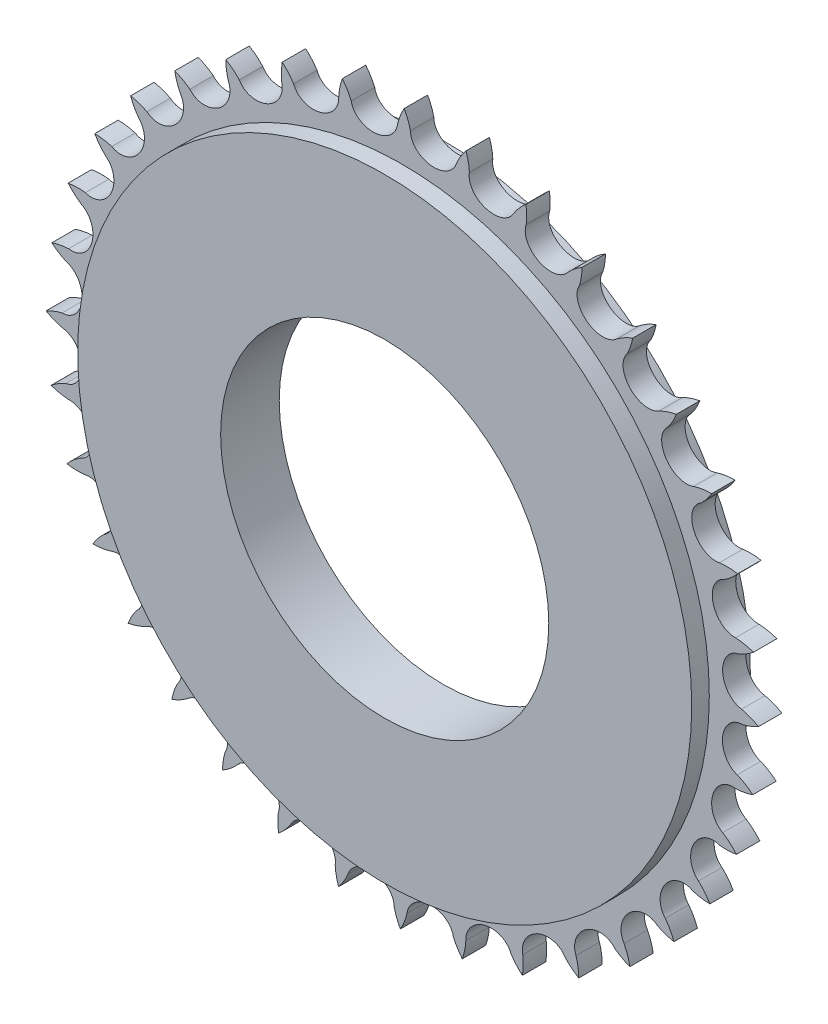
from build123d import *

# Parameters (mm, degrees)
SKETCH1_R           = 35
BOSS_EXTRUDE1_DEPTH = 2.5
SKETCH2_R           = 65.5
SKETCH2_R_2         = 35
BOSS_EXTRUDE2_DEPTH = 6.25


with BuildPart() as part:
    # Sketch1 → Boss-Extrude1 (new, symmetric)
    with BuildSketch(Plane.XY):
        with BuildLine():
            ThreePointArc((14.312905663, 71.168394833), (14.082724944, 72.996610627), (13.596372675, 74.77391691))
            ThreePointArc((13.596372675, 74.77391691), (12.458797356, 73.189476577), (11.571086117, 71.452669872))
            add(Edge.make_bspline(
                [(6.714453556, 68.295982547), (10.582574124, 68.27534589), (11.571086117, 71.452669872)],
                knots=[4.71238898, 4.71238898, 4.71238898, 6.02930256, 6.02930256, 6.02930256], degree=2, weights=[1, 0.790937459, 1]))
            add(Edge.make_bspline(
                [(1.737198395, 72.572596986), (1.714524712, 68.322657469), (6.714453556, 68.295982547)],
                knots=[3.141592654, 3.141592654, 3.141592654, 4.71238898, 4.71238898, 4.71238898], degree=2, weights=[1, 0.707106781, 1]))
            ThreePointArc((1.737198395, 72.572596986), (1.193048297, 74.333067612), (0.405458815, 75.998918434))
            ThreePointArc((0.405458815, 75.998918434), (-0.439699002, 74.241011429), (-1.012330594, 72.376441281))
            add(Edge.make_bspline(
                [(-5.247026992, 68.424365736), (-1.434088349, 69.075734684), (-1.012330594, 72.376441281)],
                knots=[4.71238898, 4.71238898, 4.71238898, 6.02930256, 6.02930256, 6.02930256], degree=2, weights=[1, 0.790937459, 1]))
            add(Edge.make_bspline(
                [(-10.891292767, 71.771717504), (-10.175627734, 67.582406873), (-5.247026992, 68.424365736)],
                knots=[0, 0, 0, 1.570796327, 1.570796327, 1.570796327], degree=2, weights=[1, 0.707106781, 1]))
            ThreePointArc((-10.891292767, 71.771717504), (-11.732878518, 73.410951952), (-12.797774707, 74.914731279))
            ThreePointArc((-12.797774707, 74.914731279), (-13.324835329, 73.036770716), (-13.564988152, 71.101091146))
            add(Edge.make_bspline(
                [(-17.04907928, 66.473709196), (-13.407176773, 67.777292233), (-13.564988152, 71.101091146)],
                knots=[4.71238898, 4.71238898, 4.71238898, 6.02930256, 6.02930256, 6.02930256], degree=2, weights=[1, 0.790937459, 1]))
            add(Edge.make_bspline(
                [(-23.18885751, 68.790090703), (-21.75659888, 64.788699043), (-17.04907928, 66.473709196)],
                knots=[0, 0, 0, 1.570796327, 1.570796327, 1.570796327], degree=2, weights=[1, 0.707106781, 1]))
            ThreePointArc((-23.18885751, 68.790090703), (-24.302307757, 70.258281665), (-25.612154319, 71.554297922))
            ThreePointArc((-25.612154319, 71.554297922), (-25.805103277, 69.613344683), (-25.705480409, 67.665370336))
            add(Edge.make_bspline(
                [(-28.333103921, 62.50328264), (-24.972894916, 64.419471055), (-25.705480409, 67.665370336)],
                knots=[4.71238898, 4.71238898, 4.71238898, 6.02930256, 6.02930256, 6.02930256], degree=2, weights=[1, 0.790937459, 1]))
            add(Edge.make_bspline(
                [(-34.781840551, 63.718311806), (-32.676506779, 60.026419378), (-28.333103921, 62.50328264)],
                knots=[0, 0, 0, 1.570796327, 1.570796327, 1.570796327], degree=2, weights=[1, 0.707106781, 1]))
            ThreePointArc((-34.781840551, 63.718311806), (-36.133323673, 64.970849042), (-37.648321583, 66.019723431))
            ThreePointArc((-37.648321583, 66.019723431), (-37.50129622, 64.074752399), (-37.064924652, 62.173671488))
            add(Edge.make_bspline(
                [(-38.756241537, 56.633725469), (-35.779824283, 59.104296847), (-37.064924652, 62.173671488)],
                knots=[4.71238898, 4.71238898, 4.71238898, 6.02930256, 6.02930256, 6.02930256], degree=2, weights=[1, 0.790937459, 1]))
            add(Edge.make_bspline(
                [(-45.317994968, 56.710484248), (-42.603555554, 53.440267334), (-38.756241537, 56.633725469)],
                knots=[3.141592654, 3.141592654, 3.141592654, 4.71238898, 4.71238898, 4.71238898], degree=2, weights=[1, 0.707106781, 1]))
            ThreePointArc((-45.317994968, 56.710484248), (-46.866446833, 57.709310048), (-48.540563647, 58.479173052))
            ThreePointArc((-48.540563647, 58.479173052), (-48.058031254, 56.589281186), (-47.298169915, 54.792857093))
            add(Edge.make_bspline(
                [(-48.001790366, 49.043381207), (-45.499601795, 51.993268487), (-47.298169915, 54.792857093)],
                knots=[4.71238898, 4.71238898, 4.71238898, 6.02930256, 6.02930256, 6.02930256], degree=2, weights=[1, 0.790937459, 1]))
            add(Edge.make_bspline(
                [(-54.47718504, 47.979537323), (-51.236116852, 45.23035981), (-48.001790366, 49.043381207)],
                knots=[0, 0, 0, 1.570796327, 1.570796327, 1.570796327], degree=2, weights=[1, 0.707106781, 1]))
            ThreePointArc((-54.47718504, 47.979537323), (-56.175556721, 48.69430287), (-57.957925247, 49.161762591))
            ThreePointArc((-57.957925247, 49.161762591), (-57.154547327, 47.3843733), (-56.094284219, 45.747189463))
            add(Edge.make_bspline(
                [(-55.788829084, 39.962878625), (-53.836896931, 43.302450974), (-56.094284219, 45.747189463)],
                knots=[4.71238898, 4.71238898, 4.71238898, 6.02930256, 6.02930256, 6.02930256], degree=2, weights=[1, 0.790937459, 1]))
            add(Edge.make_bspline(
                [(-61.981113411, 37.790756435), (-58.311894666, 35.64615069), (-55.788829084, 39.962878625)],
                knots=[0, 0, 0, 1.570796327, 1.570796327, 1.570796327], degree=2, weights=[1, 0.707106781, 1]))
            ThreePointArc((-61.981113411, 37.790756435), (-63.777800745, 38.19974394), (-65.614264617, 38.350596851))
            ThreePointArc((-65.614264617, 38.350596851), (-64.514451401, 36.739715208), (-63.186002082, 35.311516629))
            add(Edge.make_bspline(
                [(-61.880752461, 29.668124198), (-60.538385196, 33.2959104), (-63.186002082, 35.311516629)],
                knots=[1.570796327, 1.570796327, 1.570796327, 2.887709906, 2.887709906, 2.887709906], degree=2, weights=[1, 0.790937459, 1]))
            add(Edge.make_bspline(
                [(-67.601777015, 26.453722536), (-63.615895068, 24.978851319), (-61.880752461, 29.668124198)],
                knots=[0, 0, 0, 1.570796327, 1.570796327, 1.570796327], degree=2, weights=[1, 0.707106781, 1]))
            ThreePointArc((-67.601777015, 26.453722536), (-69.442188566, 26.54450512), (-71.276947758, 26.374167631))
            ThreePointArc((-71.276947758, 26.374167631), (-69.914116515, 24.978739462), (-68.357845246, 23.802921231))
            add(Edge.make_bspline(
                [(-66.092460487, 18.47191883), (-65.40044526, 22.277690438), (-68.357845246, 23.802921231)],
                knots=[4.71238898, 4.71238898, 4.71238898, 6.02930256, 6.02930256, 6.02930256], degree=2, weights=[1, 0.790937459, 1]))
            add(Edge.make_bspline(
                [(-71.168394833, 14.312905663), (-66.98695869, 13.552582191), (-66.092460487, 18.47191883)],
                knots=[0, 0, 0, 1.570796327, 1.570796327, 1.570796327], degree=2, weights=[1, 0.707106781, 1]))
            ThreePointArc((-71.168394833, 14.312905663), (-72.996610627, 14.082724944), (-74.77391691, 13.596372675))
            ThreePointArc((-74.77391691, 13.596372675), (-73.189476577, 12.458797356), (-71.452669872, 11.571086117))
            add(Edge.make_bspline(
                [(-68.295982547, 6.714453556), (-68.27534589, 10.582574124), (-71.452669872, 11.571086117)],
                knots=[4.71238898, 4.71238898, 4.71238898, 6.02930256, 6.02930256, 6.02930256], degree=2, weights=[1, 0.790937459, 1]))
            add(Edge.make_bspline(
                [(-72.572596986, 1.737198395), (-68.322657469, 1.714524712), (-68.295982547, 6.714453556)],
                knots=[3.141592654, 3.141592654, 3.141592654, 4.71238898, 4.71238898, 4.71238898], degree=2, weights=[1, 0.707106781, 1]))
            ThreePointArc((-72.572596986, 1.737198395), (-74.333067612, 1.193048297), (-75.998918434, 0.405458815))
            ThreePointArc((-75.998918434, 0.405458815), (-74.241011429, -0.439699002), (-72.376441281, -1.012330594))
            add(Edge.make_bspline(
                [(-68.424365735, -5.247026992), (-69.075734684, -1.434088349), (-72.376441281, -1.012330594)],
                knots=[1.570796327, 1.570796327, 1.570796327, 2.887709906, 2.887709906, 2.887709906], degree=2, weights=[1, 0.790937459, 1]))
            add(Edge.make_bspline(
                [(-71.771717504, -10.891292767), (-67.582406873, -10.175627734), (-68.424365735, -5.247026992)],
                knots=[0, 0, 0, 1.570796327, 1.570796327, 1.570796327], degree=2, weights=[1, 0.707106781, 1]))
            ThreePointArc((-71.771717504, -10.891292767), (-73.410951952, -11.732878518), (-74.914731279, -12.797774707))
            ThreePointArc((-74.914731279, -12.797774707), (-73.036770716, -13.324835329), (-71.101091146, -13.564988152))
            add(Edge.make_bspline(
                [(-66.473709196, -17.04907928), (-67.777292233, -13.407176773), (-71.101091146, -13.564988152)],
                knots=[1.570796327, 1.570796327, 1.570796327, 2.887709906, 2.887709906, 2.887709906], degree=2, weights=[1, 0.790937459, 1]))
            add(Edge.make_bspline(
                [(-68.790090703, -23.18885751), (-64.788699043, -21.75659888), (-66.473709196, -17.04907928)],
                knots=[0, 0, 0, 1.570796327, 1.570796327, 1.570796327], degree=2, weights=[1, 0.707106781, 1]))
            ThreePointArc((-68.790090703, -23.18885751), (-70.258281665, -24.302307757), (-71.554297922, -25.612154319))
            ThreePointArc((-71.554297922, -25.612154319), (-69.613344683, -25.805103277), (-67.665370336, -25.705480409))
            add(Edge.make_bspline(
                [(-62.50328264, -28.333103921), (-64.419471055, -24.972894916), (-67.665370336, -25.705480409)],
                knots=[4.71238898, 4.71238898, 4.71238898, 6.02930256, 6.02930256, 6.02930256], degree=2, weights=[1, 0.790937459, 1]))
            add(Edge.make_bspline(
                [(-63.718311806, -34.781840551), (-60.026419378, -32.676506779), (-62.50328264, -28.333103921)],
                knots=[0, 0, 0, 1.570796327, 1.570796327, 1.570796327], degree=2, weights=[1, 0.707106781, 1]))
            ThreePointArc((-63.718311806, -34.781840551), (-64.970849042, -36.133323673), (-66.019723431, -37.648321583))
            ThreePointArc((-66.019723431, -37.648321583), (-64.074752399, -37.50129622), (-62.173671488, -37.064924652))
            add(Edge.make_bspline(
                [(-56.633725469, -38.756241537), (-59.104296847, -35.779824283), (-62.173671488, -37.064924652)],
                knots=[4.71238898, 4.71238898, 4.71238898, 6.02930256, 6.02930256, 6.02930256], degree=2, weights=[1, 0.790937459, 1]))
            add(Edge.make_bspline(
                [(-56.710484248, -45.317994968), (-53.440267334, -42.603555554), (-56.633725469, -38.756241537)],
                knots=[3.141592654, 3.141592654, 3.141592654, 4.71238898, 4.71238898, 4.71238898], degree=2, weights=[1, 0.707106781, 1]))
            ThreePointArc((-56.710484248, -45.317994968), (-57.709310048, -46.866446833), (-58.479173052, -48.540563647))
            ThreePointArc((-58.479173052, -48.540563647), (-56.589281186, -48.058031254), (-54.792857093, -47.298169915))
            add(Edge.make_bspline(
                [(-49.043381207, -48.001790366), (-51.993268487, -45.499601795), (-54.792857093, -47.298169915)],
                knots=[1.570796327, 1.570796327, 1.570796327, 2.887709906, 2.887709906, 2.887709906], degree=2, weights=[1, 0.790937459, 1]))
            add(Edge.make_bspline(
                [(-47.979537323, -54.47718504), (-45.23035981, -51.236116852), (-49.043381207, -48.001790366)],
                knots=[0, 0, 0, 1.570796327, 1.570796327, 1.570796327], degree=2, weights=[1, 0.707106781, 1]))
            ThreePointArc((-47.979537323, -54.47718504), (-48.69430287, -56.175556721), (-49.161762591, -57.957925247))
            ThreePointArc((-49.161762591, -57.957925247), (-47.3843733, -57.154547327), (-45.747189463, -56.094284219))
            add(Edge.make_bspline(
                [(-39.962878625, -55.788829084), (-43.302450974, -53.836896931), (-45.747189463, -56.094284219)],
                knots=[4.71238898, 4.71238898, 4.71238898, 6.02930256, 6.02930256, 6.02930256], degree=2, weights=[1, 0.790937459, 1]))
            add(Edge.make_bspline(
                [(-37.790756435, -61.981113411), (-35.64615069, -58.311894666), (-39.962878625, -55.788829084)],
                knots=[0, 0, 0, 1.570796327, 1.570796327, 1.570796327], degree=2, weights=[1, 0.707106781, 1]))
            ThreePointArc((-37.790756435, -61.981113411), (-38.19974394, -63.777800745), (-38.350596851, -65.614264617))
            ThreePointArc((-38.350596851, -65.614264617), (-36.739715208, -64.514451401), (-35.311516629, -63.186002082))
            add(Edge.make_bspline(
                [(-29.668124198, -61.880752461), (-33.2959104, -60.538385196), (-35.311516629, -63.186002082)],
                knots=[4.71238898, 4.71238898, 4.71238898, 6.02930256, 6.02930256, 6.02930256], degree=2, weights=[1, 0.790937459, 1]))
            add(Edge.make_bspline(
                [(-26.453722536, -67.601777015), (-24.978851319, -63.615895068), (-29.668124198, -61.880752461)],
                knots=[0, 0, 0, 1.570796327, 1.570796327, 1.570796327], degree=2, weights=[1, 0.707106781, 1]))
            ThreePointArc((-26.453722536, -67.601777015), (-26.54450512, -69.442188566), (-26.374167631, -71.276947758))
            ThreePointArc((-26.374167631, -71.276947758), (-24.978739462, -69.914116515), (-23.802921231, -68.357845246))
            add(Edge.make_bspline(
                [(-18.47191883, -66.092460487), (-22.277690438, -65.40044526), (-23.802921231, -68.357845246)],
                knots=[4.71238898, 4.71238898, 4.71238898, 6.02930256, 6.02930256, 6.02930256], degree=2, weights=[1, 0.790937459, 1]))
            add(Edge.make_bspline(
                [(-14.312905663, -71.168394833), (-13.552582191, -66.98695869), (-18.47191883, -66.092460487)],
                knots=[0, 0, 0, 1.570796327, 1.570796327, 1.570796327], degree=2, weights=[1, 0.707106781, 1]))
            ThreePointArc((-14.312905663, -71.168394833), (-14.082724944, -72.996610627), (-13.596372675, -74.77391691))
            ThreePointArc((-13.596372675, -74.77391691), (-12.458797356, -73.189476577), (-11.571086117, -71.452669872))
            add(Edge.make_bspline(
                [(-6.714453556, -68.295982547), (-10.582574124, -68.27534589), (-11.571086117, -71.452669872)],
                knots=[4.71238898, 4.71238898, 4.71238898, 6.02930256, 6.02930256, 6.02930256], degree=2, weights=[1, 0.790937459, 1]))
            add(Edge.make_bspline(
                [(-1.737198395, -72.572596986), (-1.714524712, -68.322657469), (-6.714453556, -68.295982547)],
                knots=[0, 0, 0, 1.570796327, 1.570796327, 1.570796327], degree=2, weights=[1, 0.707106781, 1]))
            ThreePointArc((-1.737198395, -72.572596986), (-1.193048297, -74.333067612), (-0.405458815, -75.998918434))
            ThreePointArc((-0.405458815, -75.998918434), (0.439699002, -74.241011429), (1.012330594, -72.376441281))
            add(Edge.make_bspline(
                [(5.247026992, -68.424365736), (1.434088349, -69.075734684), (1.012330594, -72.376441281)],
                knots=[4.71238898, 4.71238898, 4.71238898, 6.02930256, 6.02930256, 6.02930256], degree=2, weights=[1, 0.790937459, 1]))
            add(Edge.make_bspline(
                [(10.891292767, -71.771717504), (10.175627734, -67.582406873), (5.247026992, -68.424365736)],
                knots=[3.141592654, 3.141592654, 3.141592654, 4.71238898, 4.71238898, 4.71238898], degree=2, weights=[1, 0.707106781, 1]))
            ThreePointArc((10.891292767, -71.771717504), (11.732878518, -73.410951952), (12.797774707, -74.914731279))
            ThreePointArc((12.797774707, -74.914731279), (13.324835329, -73.036770716), (13.564988152, -71.101091146))
            add(Edge.make_bspline(
                [(17.04907928, -66.473709196), (13.407176773, -67.777292233), (13.564988152, -71.101091146)],
                knots=[4.71238898, 4.71238898, 4.71238898, 6.02930256, 6.02930256, 6.02930256], degree=2, weights=[1, 0.790937459, 1]))
            add(Edge.make_bspline(
                [(23.18885751, -68.790090703), (21.75659888, -64.788699043), (17.04907928, -66.473709196)],
                knots=[0, 0, 0, 1.570796327, 1.570796327, 1.570796327], degree=2, weights=[1, 0.707106781, 1]))
            ThreePointArc((23.18885751, -68.790090703), (24.302307757, -70.258281665), (25.612154319, -71.554297922))
            ThreePointArc((25.612154319, -71.554297922), (25.805103277, -69.613344683), (25.705480409, -67.665370336))
            add(Edge.make_bspline(
                [(28.333103921, -62.50328264), (24.972894916, -64.419471055), (25.705480409, -67.665370336)],
                knots=[1.570796327, 1.570796327, 1.570796327, 2.887709906, 2.887709906, 2.887709906], degree=2, weights=[1, 0.790937459, 1]))
            add(Edge.make_bspline(
                [(34.781840551, -63.718311806), (32.676506779, -60.026419378), (28.333103921, -62.50328264)],
                knots=[3.141592654, 3.141592654, 3.141592654, 4.71238898, 4.71238898, 4.71238898], degree=2, weights=[1, 0.707106781, 1]))
            ThreePointArc((34.781840551, -63.718311806), (36.133323673, -64.970849042), (37.648321583, -66.019723431))
            ThreePointArc((37.648321583, -66.019723431), (37.50129622, -64.074752399), (37.064924652, -62.173671488))
            add(Edge.make_bspline(
                [(38.756241537, -56.633725469), (35.779824283, -59.104296847), (37.064924652, -62.173671488)],
                knots=[4.71238898, 4.71238898, 4.71238898, 6.02930256, 6.02930256, 6.02930256], degree=2, weights=[1, 0.790937459, 1]))
            add(Edge.make_bspline(
                [(45.317994968, -56.710484248), (42.603555554, -53.440267334), (38.756241537, -56.633725469)],
                knots=[3.141592654, 3.141592654, 3.141592654, 4.71238898, 4.71238898, 4.71238898], degree=2, weights=[1, 0.707106781, 1]))
            ThreePointArc((45.317994968, -56.710484248), (46.866446833, -57.709310048), (48.540563647, -58.479173052))
            ThreePointArc((48.540563647, -58.479173052), (48.058031254, -56.589281186), (47.298169915, -54.792857093))
            add(Edge.make_bspline(
                [(48.001790366, -49.043381207), (45.499601795, -51.993268487), (47.298169915, -54.792857093)],
                knots=[4.71238898, 4.71238898, 4.71238898, 6.02930256, 6.02930256, 6.02930256], degree=2, weights=[1, 0.790937459, 1]))
            add(Edge.make_bspline(
                [(54.47718504, -47.979537323), (51.236116852, -45.23035981), (48.001790366, -49.043381207)],
                knots=[0, 0, 0, 1.570796327, 1.570796327, 1.570796327], degree=2, weights=[1, 0.707106781, 1]))
            ThreePointArc((54.47718504, -47.979537323), (56.175556721, -48.69430287), (57.957925247, -49.161762591))
            ThreePointArc((57.957925247, -49.161762591), (57.154547327, -47.3843733), (56.094284219, -45.747189463))
            add(Edge.make_bspline(
                [(55.788829084, -39.962878625), (53.836896931, -43.302450974), (56.094284219, -45.747189463)],
                knots=[4.71238898, 4.71238898, 4.71238898, 6.02930256, 6.02930256, 6.02930256], degree=2, weights=[1, 0.790937459, 1]))
            add(Edge.make_bspline(
                [(61.981113411, -37.790756435), (58.311894666, -35.64615069), (55.788829084, -39.962878625)],
                knots=[0, 0, 0, 1.570796327, 1.570796327, 1.570796327], degree=2, weights=[1, 0.707106781, 1]))
            ThreePointArc((61.981113411, -37.790756435), (63.777800745, -38.19974394), (65.614264617, -38.350596851))
            ThreePointArc((65.614264617, -38.350596851), (64.514451401, -36.739715208), (63.186002082, -35.311516629))
            add(Edge.make_bspline(
                [(61.880752461, -29.668124198), (60.538385196, -33.2959104), (63.186002082, -35.311516629)],
                knots=[4.71238898, 4.71238898, 4.71238898, 6.02930256, 6.02930256, 6.02930256], degree=2, weights=[1, 0.790937459, 1]))
            add(Edge.make_bspline(
                [(67.601777015, -26.453722536), (63.615895068, -24.978851319), (61.880752461, -29.668124198)],
                knots=[0, 0, 0, 1.570796327, 1.570796327, 1.570796327], degree=2, weights=[1, 0.707106781, 1]))
            ThreePointArc((67.601777015, -26.453722536), (69.442188566, -26.54450512), (71.276947758, -26.374167631))
            ThreePointArc((71.276947758, -26.374167631), (69.914116515, -24.978739462), (68.357845246, -23.802921231))
            add(Edge.make_bspline(
                [(66.092460487, -18.47191883), (65.40044526, -22.277690438), (68.357845246, -23.802921231)],
                knots=[4.71238898, 4.71238898, 4.71238898, 6.02930256, 6.02930256, 6.02930256], degree=2, weights=[1, 0.790937459, 1]))
            add(Edge.make_bspline(
                [(71.168394833, -14.312905663), (66.98695869, -13.552582191), (66.092460487, -18.47191883)],
                knots=[0, 0, 0, 1.570796327, 1.570796327, 1.570796327], degree=2, weights=[1, 0.707106781, 1]))
            ThreePointArc((71.168394833, -14.312905663), (72.996610627, -14.082724944), (74.77391691, -13.596372675))
            ThreePointArc((74.77391691, -13.596372675), (73.189476577, -12.458797356), (71.452669872, -11.571086117))
            add(Edge.make_bspline(
                [(68.295982547, -6.714453556), (68.27534589, -10.582574124), (71.452669872, -11.571086117)],
                knots=[4.71238898, 4.71238898, 4.71238898, 6.02930256, 6.02930256, 6.02930256], degree=2, weights=[1, 0.790937459, 1]))
            add(Edge.make_bspline(
                [(72.572596986, -1.737198395), (68.322657469, -1.714524712), (68.295982547, -6.714453556)],
                knots=[0, 0, 0, 1.570796327, 1.570796327, 1.570796327], degree=2, weights=[1, 0.707106781, 1]))
            ThreePointArc((72.572596986, -1.737198395), (74.333067612, -1.193048297), (75.998918434, -0.405458815))
            ThreePointArc((75.998918434, -0.405458815), (74.241011429, 0.439699002), (72.376441281, 1.012330594))
            add(Edge.make_bspline(
                [(68.424365736, 5.247026992), (69.075734684, 1.434088349), (72.376441281, 1.012330594)],
                knots=[4.71238898, 4.71238898, 4.71238898, 6.02930256, 6.02930256, 6.02930256], degree=2, weights=[1, 0.790937459, 1]))
            add(Edge.make_bspline(
                [(71.771717504, 10.891292767), (67.582406873, 10.175627734), (68.424365736, 5.247026992)],
                knots=[3.141592654, 3.141592654, 3.141592654, 4.71238898, 4.71238898, 4.71238898], degree=2, weights=[1, 0.707106781, 1]))
            ThreePointArc((71.771717504, 10.891292767), (73.410951952, 11.732878518), (74.914731279, 12.797774707))
            ThreePointArc((74.914731279, 12.797774707), (73.036770716, 13.324835329), (71.101091146, 13.564988152))
            add(Edge.make_bspline(
                [(66.473709196, 17.04907928), (67.777292233, 13.407176773), (71.101091146, 13.564988152)],
                knots=[4.71238898, 4.71238898, 4.71238898, 6.02930256, 6.02930256, 6.02930256], degree=2, weights=[1, 0.790937459, 1]))
            add(Edge.make_bspline(
                [(68.790090703, 23.18885751), (64.788699043, 21.75659888), (66.473709196, 17.04907928)],
                knots=[0, 0, 0, 1.570796327, 1.570796327, 1.570796327], degree=2, weights=[1, 0.707106781, 1]))
            ThreePointArc((68.790090703, 23.18885751), (70.258281665, 24.302307757), (71.554297922, 25.612154319))
            ThreePointArc((71.554297922, 25.612154319), (69.613344683, 25.805103277), (67.665370336, 25.705480409))
            add(Edge.make_bspline(
                [(62.50328264, 28.333103921), (64.419471055, 24.972894916), (67.665370336, 25.705480409)],
                knots=[4.71238898, 4.71238898, 4.71238898, 6.02930256, 6.02930256, 6.02930256], degree=2, weights=[1, 0.790937459, 1]))
            add(Edge.make_bspline(
                [(63.718311806, 34.781840551), (60.026419378, 32.676506779), (62.50328264, 28.333103921)],
                knots=[0, 0, 0, 1.570796327, 1.570796327, 1.570796327], degree=2, weights=[1, 0.707106781, 1]))
            ThreePointArc((63.718311806, 34.781840551), (64.970849042, 36.133323673), (66.019723431, 37.648321583))
            ThreePointArc((66.019723431, 37.648321583), (64.074752399, 37.50129622), (62.173671488, 37.064924652))
            add(Edge.make_bspline(
                [(56.633725469, 38.756241537), (59.104296847, 35.779824283), (62.173671488, 37.064924652)],
                knots=[4.71238898, 4.71238898, 4.71238898, 6.02930256, 6.02930256, 6.02930256], degree=2, weights=[1, 0.790937459, 1]))
            add(Edge.make_bspline(
                [(56.710484248, 45.317994968), (53.440267334, 42.603555554), (56.633725469, 38.756241537)],
                knots=[3.141592654, 3.141592654, 3.141592654, 4.71238898, 4.71238898, 4.71238898], degree=2, weights=[1, 0.707106781, 1]))
            ThreePointArc((56.710484248, 45.317994968), (57.709310048, 46.866446833), (58.479173052, 48.540563647))
            ThreePointArc((58.479173052, 48.540563647), (56.589281186, 48.058031254), (54.792857093, 47.298169915))
            add(Edge.make_bspline(
                [(49.043381207, 48.001790366), (51.993268487, 45.499601795), (54.792857093, 47.298169915)],
                knots=[4.71238898, 4.71238898, 4.71238898, 6.02930256, 6.02930256, 6.02930256], degree=2, weights=[1, 0.790937459, 1]))
            add(Edge.make_bspline(
                [(47.979537323, 54.47718504), (45.23035981, 51.236116852), (49.043381207, 48.001790366)],
                knots=[0, 0, 0, 1.570796327, 1.570796327, 1.570796327], degree=2, weights=[1, 0.707106781, 1]))
            ThreePointArc((47.979537323, 54.47718504), (48.69430287, 56.175556721), (49.161762591, 57.957925247))
            ThreePointArc((49.161762591, 57.957925247), (47.3843733, 57.154547327), (45.747189463, 56.094284219))
            add(Edge.make_bspline(
                [(39.962878625, 55.788829084), (43.302450974, 53.836896931), (45.747189463, 56.094284219)],
                knots=[4.71238898, 4.71238898, 4.71238898, 6.02930256, 6.02930256, 6.02930256], degree=2, weights=[1, 0.790937459, 1]))
            add(Edge.make_bspline(
                [(37.790756435, 61.981113411), (35.64615069, 58.311894666), (39.962878625, 55.788829084)],
                knots=[0, 0, 0, 1.570796327, 1.570796327, 1.570796327], degree=2, weights=[1, 0.707106781, 1]))
            ThreePointArc((37.790756435, 61.981113411), (38.19974394, 63.777800745), (38.350596851, 65.614264617))
            ThreePointArc((38.350596851, 65.614264617), (36.739715208, 64.514451401), (35.311516629, 63.186002082))
            add(Edge.make_bspline(
                [(29.668124198, 61.880752461), (33.2959104, 60.538385196), (35.311516629, 63.186002082)],
                knots=[4.71238898, 4.71238898, 4.71238898, 6.02930256, 6.02930256, 6.02930256], degree=2, weights=[1, 0.790937459, 1]))
            add(Edge.make_bspline(
                [(26.453722536, 67.601777015), (24.978851319, 63.615895068), (29.668124198, 61.880752461)],
                knots=[3.141592654, 3.141592654, 3.141592654, 4.71238898, 4.71238898, 4.71238898], degree=2, weights=[1, 0.707106781, 1]))
            ThreePointArc((26.453722536, 67.601777015), (26.54450512, 69.442188566), (26.374167631, 71.276947758))
            ThreePointArc((26.374167631, 71.276947758), (24.978739462, 69.914116515), (23.802921231, 68.357845246))
            add(Edge.make_bspline(
                [(18.47191883, 66.092460487), (22.277690438, 65.40044526), (23.802921231, 68.357845246)],
                knots=[4.71238898, 4.71238898, 4.71238898, 6.02930256, 6.02930256, 6.02930256], degree=2, weights=[1, 0.790937459, 1]))
            add(Edge.make_bspline(
                [(14.312905663, 71.168394833), (13.552582191, 66.98695869), (18.47191883, 66.092460487)],
                knots=[0, 0, 0, 1.570796327, 1.570796327, 1.570796327], degree=2, weights=[1, 0.707106781, 1]))
        make_face()
        Circle(SKETCH1_R, mode=Mode.SUBTRACT)
    extrude(amount=BOSS_EXTRUDE1_DEPTH, both=True)

    # Sketch2 → Boss-Extrude2 (add, symmetric)
    with BuildSketch(Plane.XY):
        Circle(SKETCH2_R)
        Circle(SKETCH2_R_2, mode=Mode.SUBTRACT)
    extrude(amount=BOSS_EXTRUDE2_DEPTH, both=True)


solid = part.part
